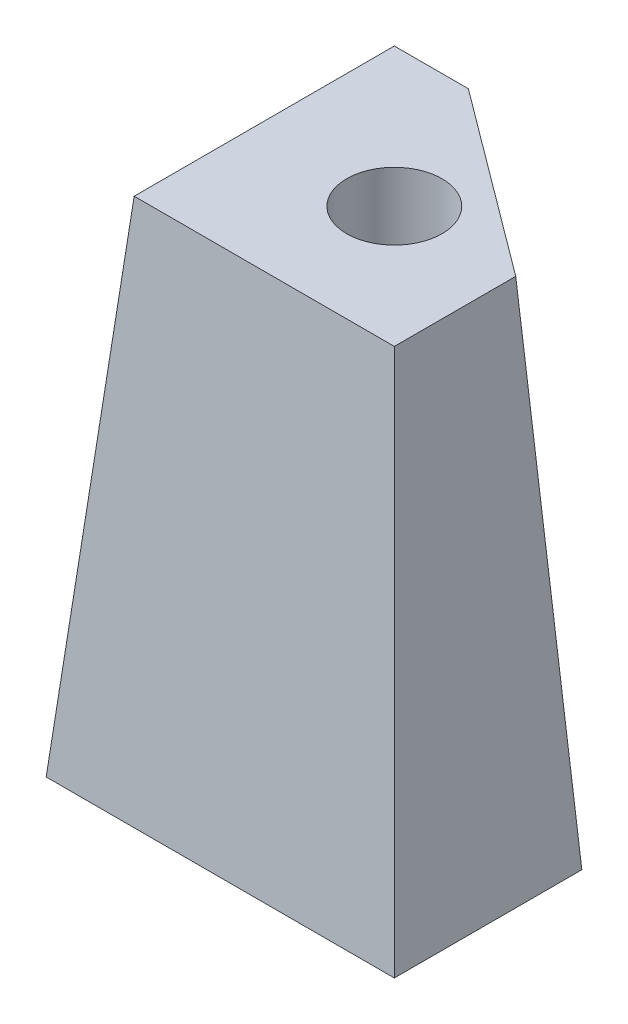
from build123d import *

# Parameters (mm, degrees)
BOSS_EXTRUDE1_DEPTH = 29
SKETCH2_R           = 2
SKETCH2_R_2         = 1.5
CUT_EXTRUDE1_DEPTH  = 10
SKETCH3_R           = 2.75
CUT_EXTRUDE2_DEPTH  = 6
DRAFT1_ANGLE        = 5


with BuildPart() as part:
    # Sketch1 → Boss-Extrude1 (new body)
    with BuildSketch(Plane(origin=(0, 0, 0), x_dir=(1, 0, 0), z_dir=(0, 1, 0))):
        Polygon((10.420353982, -7.201327434), (-4.579646018, -7.201327434), (-4.579646018, 7.798672566), (-0.312469404, 7.798672566), (10.420353982, -0.201327434), align=None)
    extrude(amount=BOSS_EXTRUDE1_DEPTH)

    # Sketch2 → Cut-Extrude1 (cut)
    with BuildSketch(Plane.XZ):
        with Locations(Location((-0.579646018, 2.201327434, 0), (0, 0, 270))):
            Circle(SKETCH2_R)
        with Locations(Location((7.420353982, 2.201327434, 0), (0, 0, 270))):
            Circle(SKETCH2_R_2)
    extrude(amount=-CUT_EXTRUDE1_DEPTH, mode=Mode.SUBTRACT)

    # Sketch3 → Cut-Extrude2 (cut)
    with BuildSketch(Plane(origin=(0, 29, 0), x_dir=(1, 0, 0), z_dir=(0, 1, 0))):
        with Locations(Location((3.420353982, -0.201327434, 0), (0, 0, 270))):
            Circle(SKETCH3_R)
    extrude(amount=-CUT_EXTRUDE2_DEPTH, mode=Mode.SUBTRACT)

    # Draft1
    draft1_faces = [part.faces().sort_by_distance(p)[0] for p in [
        (5.053942289, 14.5, -3.798672566),
        (-2.446057711, 14.5, -7.798672566),
        (-4.579646018, 14.5, -0.298672566),
        (10.420353982, 14.5, 3.701327434),
        (2.920353982, 14.5, 7.201327434),
    ]]
    draft(draft1_faces, Plane.ZX.offset(29), DRAFT1_ANGLE)


solid = part.part
